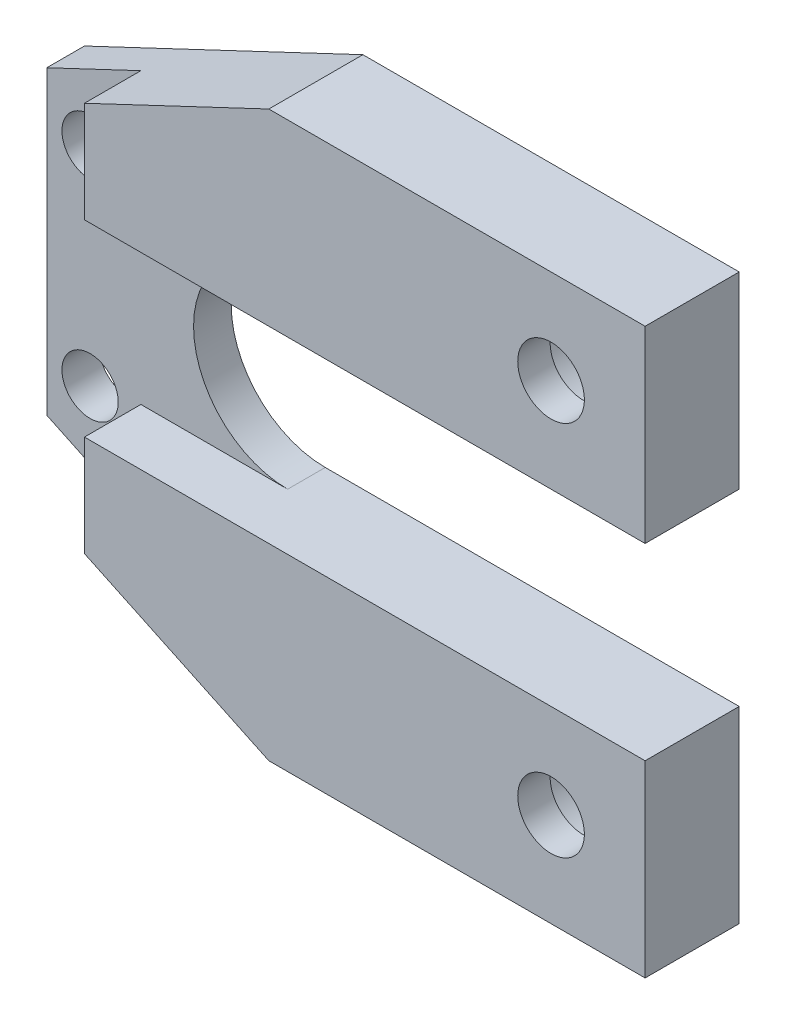
from build123d import *

# Parameters (mm, degrees)
BOSS_EXTRUDE1_DEPTH                            = 38.1
CBORE_FOR_8_SOCKET_HEAD_CAP_SCREW1_D           = 4.4958
CBORE_FOR_8_SOCKET_HEAD_CAP_SCREW1_CBORE_D     = 7.9375
CBORE_FOR_8_SOCKET_HEAD_CAP_SCREW1_CBORE_DEPTH = 4.1656
CUT_EXTRUDE1_DEPTH                             = 59.695987222
F_6_CLEARANCE_HOLE1_D                          = 3.7973
CUT_EXTRUDE2_DEPTH                             = 59.695987222
SKETCH6_W                                      = 9.906
SKETCH6_H                                      = 12.7
CUT_EXTRUDE3_DEPTH                             = 3.81


with BuildPart() as part:
    # Sketch1 → Boss-Extrude1 (new body)
    with BuildSketch(Plane(origin=(0, 0, 0), x_dir=(1, 0, 0), z_dir=(0, 1, 0))):
        Polygon((0, 0), (6.35, 0), (6.35, -3.81), (44.196, -3.81), (44.196, -0.814646677), (44.196, 2.54), (0, 2.54), align=None)
    extrude(amount=BOSS_EXTRUDE1_DEPTH)

    # CBORE for #8 Socket Head Cap Screw1 (through all)
    with Locations(Plane(origin=(37.846, 31.75, -2.54), x_dir=(-1, 0, 0), z_dir=(0, 0, -1))):
        with Locations((0, 0), (0, -25.4)):
            CounterBoreHole(CBORE_FOR_8_SOCKET_HEAD_CAP_SCREW1_D / 2, CBORE_FOR_8_SOCKET_HEAD_CAP_SCREW1_CBORE_D / 2, CBORE_FOR_8_SOCKET_HEAD_CAP_SCREW1_CBORE_DEPTH)

    # Sketch3 → Cut-Extrude1 (cut, through all)
    with BuildSketch(Plane(origin=(0, 0, -2.54), x_dir=(-1, 0, 0), z_dir=(0, 0, -1))):
        Polygon((0, 29.21), (-18.796, 38.1), (0, 38.1), align=None)
        Polygon((0, 8.89), (-18.796, 0), (0, 0), align=None)
    extrude(amount=-CUT_EXTRUDE1_DEPTH, mode=Mode.SUBTRACT)

    # #6 Clearance Hole1 (through all)
    with Locations(Plane(origin=(2.921, 26.035, -2.54), x_dir=(-1, 0, 0), z_dir=(0, 0, -1))):
        with Locations((0, 0), (0, -13.97)):
            Hole(F_6_CLEARANCE_HOLE1_D / 2)

    # Sketch5 → Cut-Extrude2 (cut, through all)
    with BuildSketch(Plane(origin=(0, 0, -2.54), x_dir=(-1, 0, 0), z_dir=(0, 0, -1))):
        with BuildLine():
            Line((-16.256, 12.7), (-44.196, 12.7))
            Line((-44.196, 12.7), (-44.196, 25.4))
            Line((-44.196, 25.4), (-16.256, 25.4))
            ThreePointArc((-16.256, 25.4), (-9.906, 19.05), (-16.256, 12.7))
        make_face()
    extrude(amount=-CUT_EXTRUDE2_DEPTH, mode=Mode.SUBTRACT)

    # Sketch6 → Cut-Extrude3 (cut)
    with BuildSketch(Plane.XY.offset(3.81)):
        with Locations((11.303, 19.05)):
            Rectangle(SKETCH6_W, SKETCH6_H)
    extrude(amount=-CUT_EXTRUDE3_DEPTH, mode=Mode.SUBTRACT)


solid = part.part
